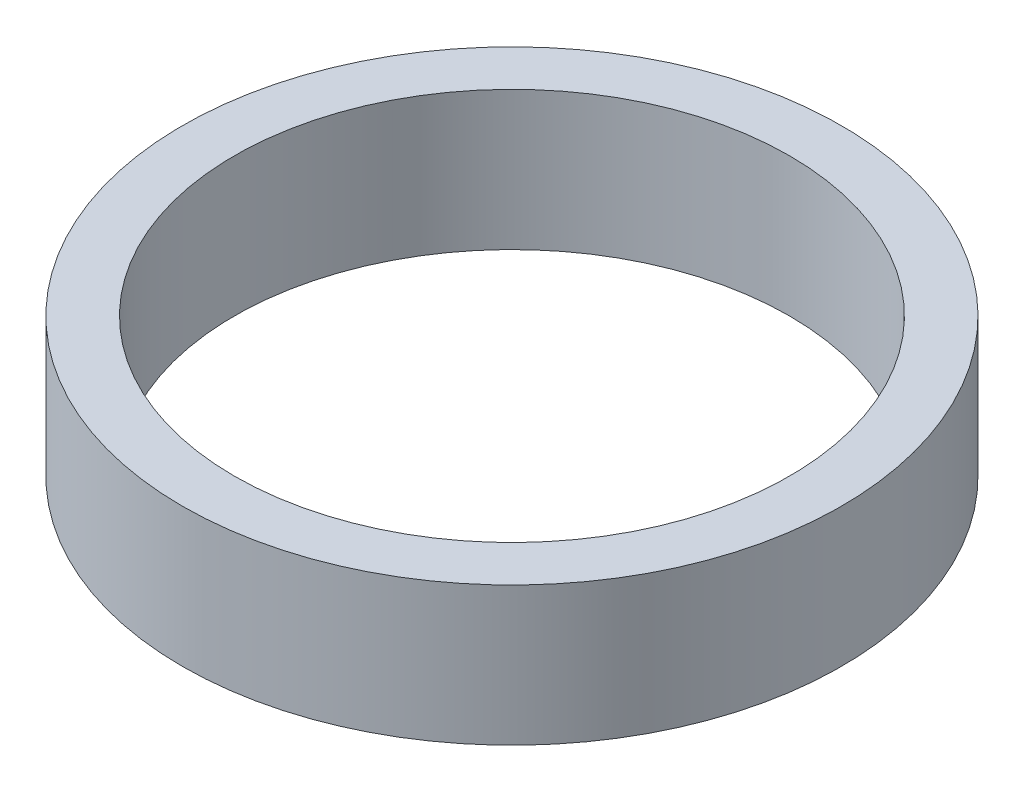
from build123d import *

# Parameters (mm, degrees)
SKETCH1_R           = 30.1625
SKETCH1_R_2         = 25.4
BOSS_EXTRUDE1_DEPTH = 6.35


with BuildPart() as part:
    # Sketch1 → Boss-Extrude1 (new, symmetric)
    with BuildSketch(Plane(origin=(0, 0, 0), x_dir=(1, 0, 0), z_dir=(0, 1, 0))):
        with Locations(Location((0, 0, 0), (0, 0, 270))):
            Circle(SKETCH1_R)
        with Locations(Location((0, 0, 0), (0, 0, 270))):
            Circle(SKETCH1_R_2, mode=Mode.SUBTRACT)
    extrude(amount=BOSS_EXTRUDE1_DEPTH, both=True)


solid = part.part
